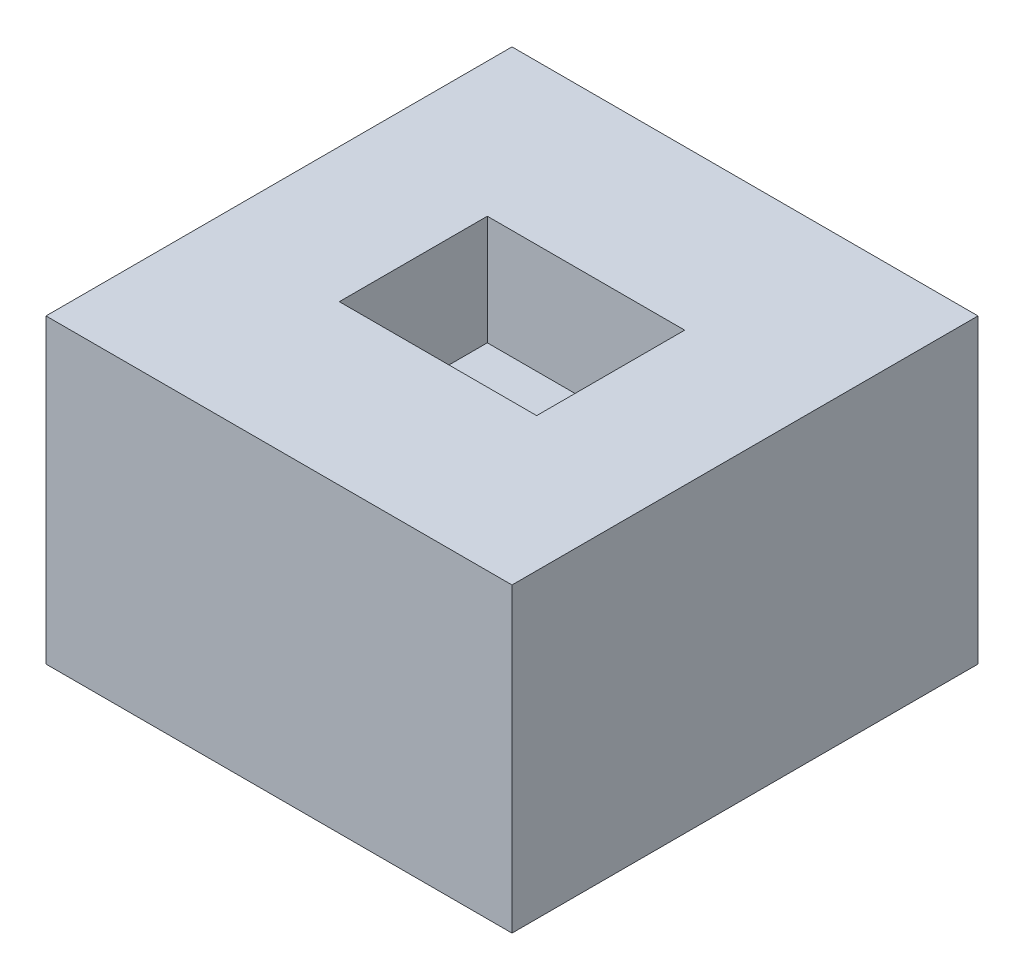
from build123d import *

# Parameters (mm, degrees)
SKETCH1_W           = 8.5
SKETCH1_H           = 8.5
BOSS_EXTRUDE1_DEPTH = 5.5
SKETCH2_W           = 3.6
SKETCH2_H           = 2.7
CUT_EXTRUDE1_DEPTH  = 2


with BuildPart() as part:
    # Sketch1 → Boss-Extrude1 (new body)
    with BuildSketch(Plane(origin=(0, 0, 0), x_dir=(1, 0, 0), z_dir=(0, 1, 0))):
        Rectangle(SKETCH1_W, SKETCH1_H)
    extrude(amount=BOSS_EXTRUDE1_DEPTH)

    # Sketch2 → Cut-Extrude1 (cut)
    with BuildSketch(Plane(origin=(0, 5.5, 0), x_dir=(1, 0, 0), z_dir=(0, 1, 0))):
        Rectangle(SKETCH2_W, SKETCH2_H)
    extrude(amount=-CUT_EXTRUDE1_DEPTH, mode=Mode.SUBTRACT)


solid = part.part
